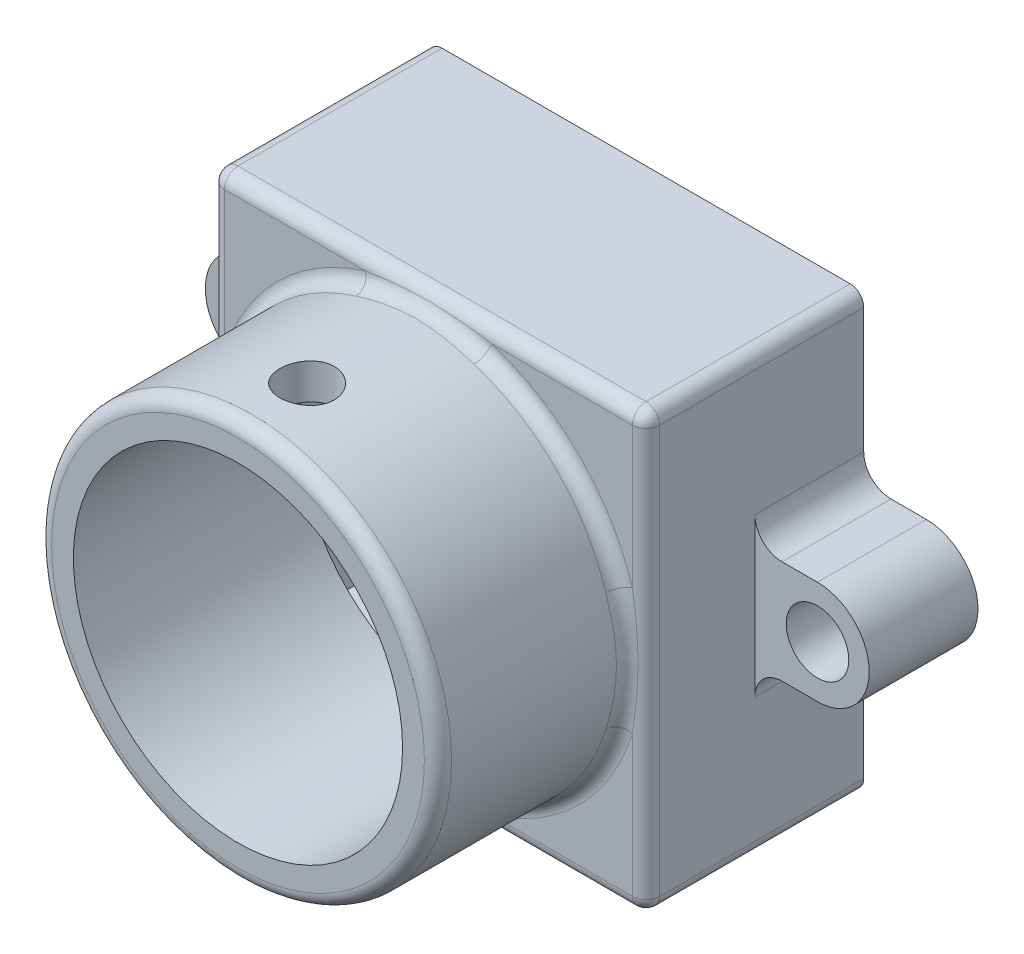
from build123d import *

# Parameters (mm, degrees)
SKETCH1_W          = 16
SKETCH1_H          = 16
EXTRUDE1_DEPTH     = 8
SKETCH2_R          = 7.35
EXTRUDE2_DEPTH     = 7
SHELL1_T           = -1.3
SKETCH6_R          = 1
CUT_EXTRUDE1_DEPTH = 19.788294228
SKETCH4_R          = 1.15
EXTRUDE3_DEPTH     = 4
FILLET1_R          = 0.5
FILLET2_R          = 0.5
FILLET3_R          = 1


with BuildPart() as part:
    # Sketch1 → Extrude1 (new body)
    with BuildSketch(Plane.XY):
        Rectangle(SKETCH1_W, SKETCH1_H)
    extrude(amount=EXTRUDE1_DEPTH)

    # Sketch2 → Extrude2 (add)
    with BuildSketch(Plane.XY.offset(8)):
        Circle(SKETCH2_R)
    extrude(amount=EXTRUDE2_DEPTH)

    # Shell1
    shell1_openings = [part.faces().sort_by_distance(p)[0] for p in [
        (0, 0, 15),
        (0, 0, 0),
    ]]
    offset(amount=SHELL1_T, openings=shell1_openings, kind=Kind.INTERSECTION)

    # Sketch6 → Cut-Extrude1 (cut, through all)
    with BuildSketch(Plane(origin=(0, 0, 0), x_dir=(1, 0, 0), z_dir=(0, 1, 0))):
        with Locations(Location((0, -12.46, 0), (0, 0, 90))):
            Circle(SKETCH6_R)
    extrude(amount=CUT_EXTRUDE1_DEPTH, mode=Mode.SUBTRACT)

    # Sketch4 → Extrude3 (add)
    # profile 1 of 2: a face of its own
    with BuildSketch(Plane.XY):
        with BuildLine():
            Line((-8, 1.9), (-10.3, 1.9))
            ThreePointArc((-10.3, 1.9), (-12.2, 0), (-10.3, -1.9))
            Line((-10.3, -1.9), (-8, -1.9))
            Line((-8, -1.9), (-8, 1.9))
        make_face()
        with Locations((-10.3, 0)):
            Circle(SKETCH4_R, mode=Mode.SUBTRACT)
    # profile 2 of 2: a face of its own
    with BuildSketch(Plane.XY):
        with BuildLine():
            Line((8, 1.9), (8, -1.9))
            Line((8, -1.9), (10.3, -1.9))
            ThreePointArc((10.3, -1.9), (12.2, 0), (10.3, 1.9))
            Line((10.3, 1.9), (8, 1.9))
        make_face()
        with Locations((10.3, 0)):
            Circle(SKETCH4_R, mode=Mode.SUBTRACT)
    extrude(amount=EXTRUDE3_DEPTH)

    # Fillet1
    fillet1_edges = [part.edges().sort_by_distance(p)[0] for p in [
        (-8, 8, 4),
        (-8, -8, 4),
        (8, -8, 4),
        (8, 8, 4),
        (0, -8, 8),
        (-8, 0, 8),
        (0, 8, 8),
        (8, 0, 8),
    ]]
    fillet(fillet1_edges, radius=FILLET1_R)

    # Fillet2
    fillet2_edges = [part.edges().sort_by_distance(p)[0] for p in [
        (-7.35, 0, 8),
        (-7.35, 0, 15),
    ]]
    fillet(fillet2_edges, radius=FILLET2_R)

    # Fillet3
    fillet3_edges = [part.edges().sort_by_distance(p)[0] for p in [
        (8, 1.9, 2),
        (8, -1.9, 2),
        (-8, -1.9, 2),
        (-8, 1.9, 2),
    ]]
    fillet(fillet3_edges, radius=FILLET3_R)


solid = part.part
